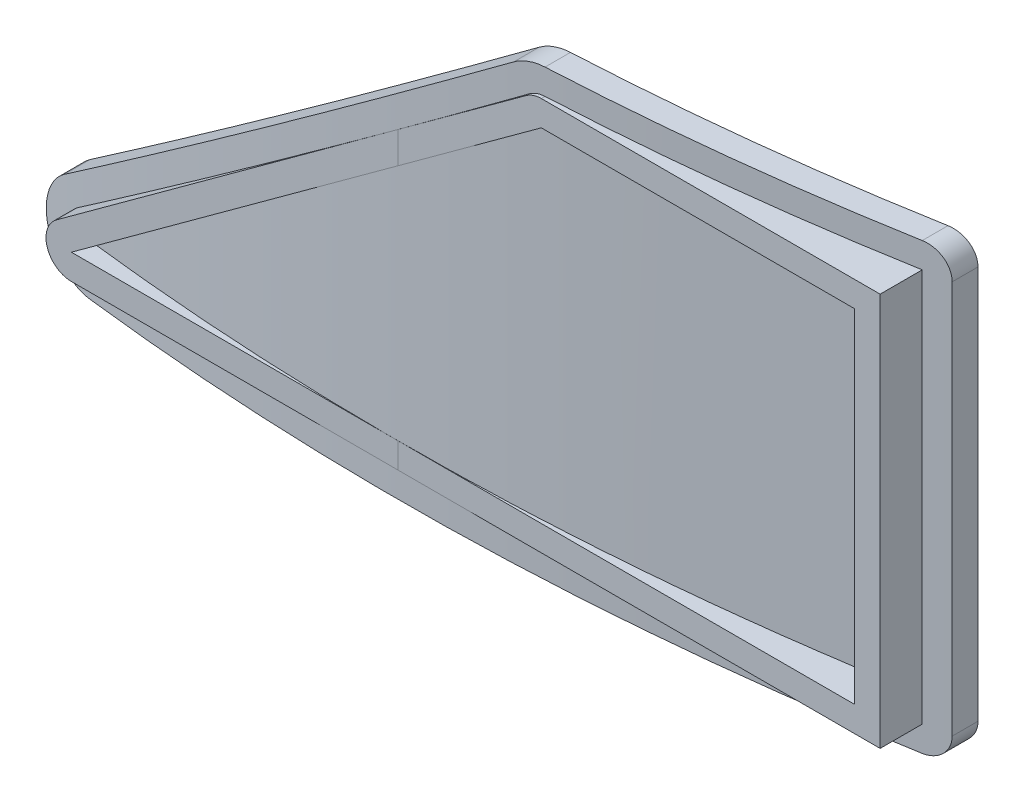
from build123d import *

# Parameters (mm, degrees)
BOSS_EXTRUDE1_DEPTH      = 175
FILLET1_R                = 10
CUT_EXTRUDE3_DEPTH       = 1129.731146152
CUT_EXTRUDE3_DEPTH_BACK  = 1129.731146152
SKETCH4_OUTSIDE_W        = 489.508
SKETCH4_OUTSIDE_H        = 264.508
FILLET4_R                = 20
BOSS_EXTRUDE3_REACH      = 269.284
BOSS_EXTRUDE3_END_RADIUS = 1097


with BuildPart() as part:
    # Sketch1 → Boss-Extrude1 (new body)
    with BuildSketch(Plane(origin=(0, 0, 0), x_dir=(1, 0, 0), z_dir=(0, 1, 0))):
        with BuildLine():
            Line((-200, -1068.442324134), (-200, -1078.614388927))
            ThreePointArc((-200, -1078.614388927), (0, -1097), (200, -1078.614388927))
            Line((200, -1078.614388927), (200, -1068.442324134))
            ThreePointArc((200, -1068.442324134), (0, -1087), (-200, -1068.442324134))
        make_face()
    extrude(amount=BOSS_EXTRUDE1_DEPTH)

    # Fillet1
    fillet1_edges = [part.edges().sort_by_distance(p)[0] for p in [
        (200, 175, 1073.52835653),
        (200, 0, 1073.52835653),
        (-200, 0, 1073.52835653),
        (-200, 175, 1073.52835653),
    ]]
    fillet(fillet1_edges, radius=FILLET1_R)

    # Sketch4 outside → Cut-Extrude3 (cut, two sides: drawn at the far end of the back side and taken through both)
    with BuildSketch(Plane.XY.offset(-CUT_EXTRUDE3_DEPTH_BACK)):
        with Locations((0, 87.5)):
            Rectangle(SKETCH4_OUTSIDE_W, SKETCH4_OUTSIDE_H)
        Polygon((-190, 0), (50, 175), (200, 175), (200, 0), align=None, mode=Mode.SUBTRACT)
    extrude(amount=CUT_EXTRUDE3_DEPTH + CUT_EXTRUDE3_DEPTH_BACK, mode=Mode.SUBTRACT)

    # Fillet4
    fillet4_edges = [part.edges().sort_by_distance(p)[0] for p in [
        (-190, 0, 1075.343303099),
        (50, 175, 1090.854686691),
    ]]
    fillet(fillet4_edges, radius=FILLET4_R)


with BuildPart() as body_2:
    # Boss-Extrude3: up to this cylinder (the profile starts outside it)
    boss_extrude3_end = Plane(origin=(0, 92.644219, 0), z_dir=(0, -1, 0)) * Cylinder(BOSS_EXTRUDE3_END_RADIUS, 2733.568, mode=Mode.PRIVATE)
    # Sketch5 → Boss-Extrude3 (new, up to the surface)
    with BuildSketch(Plane.XY.offset(1097), mode=Mode.PRIVATE) as boss_extrude3_sk1:
        with BuildLine():
            Line((50.625642403, 163.080075302), (-134.51721474, 28.080075302))
            ThreePointArc((-134.51721474, 28.080075302), (-138.133404424, 16.901674083), (-128.625493165, 10))
            Line((-128.625493165, 10), (190, 10))
            Line((190, 10), (190, 165))
            Line((190, 165), (56.517363978, 165))
            ThreePointArc((56.517363978, 165), (53.419038061, 164.507911259), (50.625642403, 163.080075302))
        make_face()
        Polygon((56.517363978, 155), (-128.625493165, 20), (180, 20), (180, 155), align=None, mode=Mode.SUBTRACT)
    boss_extrude3_tool1 = extrude(boss_extrude3_sk1.sketch, amount=-BOSS_EXTRUDE3_REACH, mode=Mode.PRIVATE) - boss_extrude3_end
    add(boss_extrude3_tool1.solids().sort_by_distance((-39.805058, 92.644219, 1097))[0])
    add(boss_extrude3_tool1.solids().sort_by_distance((-39.805058, 92.644219, 1097))[1])


solid = Compound([part.part, body_2.part])
